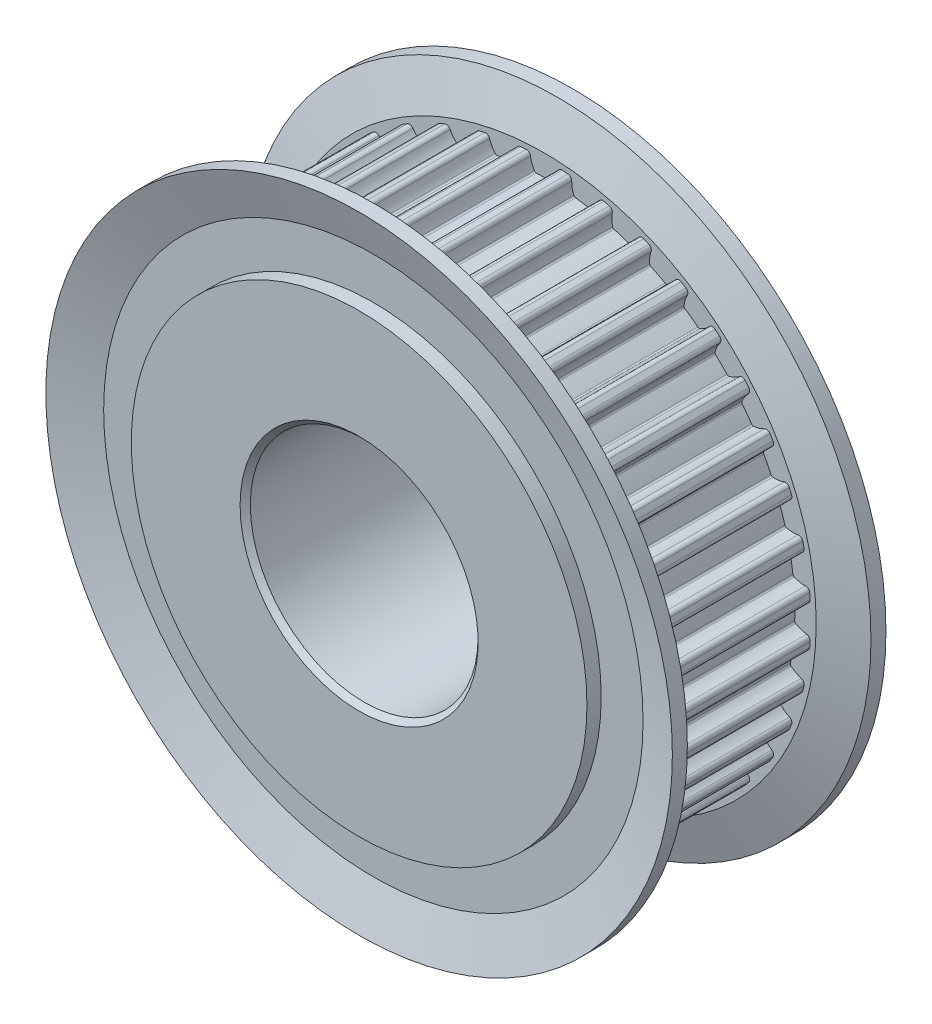
from build123d import *

# Parameters (mm, degrees)
EXTRUDE_1_DEPTH          = 5.5
PATTERN_CIRCULAR_1_COUNT = 40
CUT_EXTRUDE_1_DEPTH      = 33.003906012
CUT_EXTRUDE_1_DEPTH_BACK = 33.003906012
SKETCH_6_R               = 8
CHAMFER_1_SIZE           = 0.36


with BuildPart() as part:
    # 草图3 → 旋转1 (revolve)
    with BuildSketch(Plane(origin=(0, 0, 0), x_dir=(0, 0, -1), z_dir=(1, 0, 0))):
        Polygon((7.5, 0), (7.5, 16), (6.5, 16), (6.5, 18.940710283), (7.5, 22), (6.447932451, 22), (5.5, 19.1), (5.5, 17.6), (-5.5, 17.6), (-5.5, 19.1), (-6.447932451, 22), (-7.5, 22), (-6.5, 18.940710283), (-6.5, 16), (-7.5, 16), (-7.5, 0), align=None)
    revolve(axis=Axis((0, 0, 7.5), (0, 0, -1)))

    # 草图4 → 凸台-拉伸1 (add, symmetric)
    with BuildSketch(Plane.XY):
        with BuildLine():
            ThreePointArc((-1.269810781, 18.676883589), (-1.468754272, 18.662292487), (-1.667530989, 18.645582329))
            ThreePointArc((-1.667530989, 18.645582329), (-1.858080179, 18.549812804), (-1.931611409, 18.349628004))
            ThreePointArc((-1.931611409, 18.349628004), (-1.963515241, 17.944424411), (-2.07769221, 17.55433285))
            ThreePointArc((-2.07769221, 17.55433285), (-2.125287008, 17.492018457), (-2.197820984, 17.462233045))
            ThreePointArc((-2.197820984, 17.462233045), (-1.380880085, 17.545745074), (-0.560932924, 17.591058929))
            ThreePointArc((-0.560932924, 17.591058929), (-0.637233351, 17.60913082), (-0.693990297, 17.663232553))
            ThreePointArc((-0.693990297, 17.663232553), (-0.867785323, 18.030660226), (-0.962684173, 18.425884231))
            ThreePointArc((-0.962684173, 18.425884231), (-1.066625913, 18.612101605), (-1.269810781, 18.676883589))
        make_face()
    extrude_1 = extrude(amount=EXTRUDE_1_DEPTH, both=True)

    # 阵列(圆周)1: 凸台-拉伸1 ×40 about axis
    pattern_circular_1_axis = Axis((0, 0, 7.5), (0, 0, 1))
    for i in range(1, PATTERN_CIRCULAR_1_COUNT):
        add(extrude_1.rotate(pattern_circular_1_axis, i * 360 / PATTERN_CIRCULAR_1_COUNT))

    # 草图6 → 切除-拉伸1 (cut, two sides: drawn at the far end of the back side and taken through both)
    with BuildSketch(Plane.XY.offset(-CUT_EXTRUDE_1_DEPTH_BACK)):
        Circle(SKETCH_6_R)
    extrude(amount=CUT_EXTRUDE_1_DEPTH + CUT_EXTRUDE_1_DEPTH_BACK, mode=Mode.SUBTRACT)

    # 倒角1
    chamfer_1_edges = [part.edges().sort_by_distance(p)[0] for p in [
        (-8, 0, -7.5),
        (-8, 0, 7.5),
    ]]
    chamfer(chamfer_1_edges, length=CHAMFER_1_SIZE)


solid = part.part
